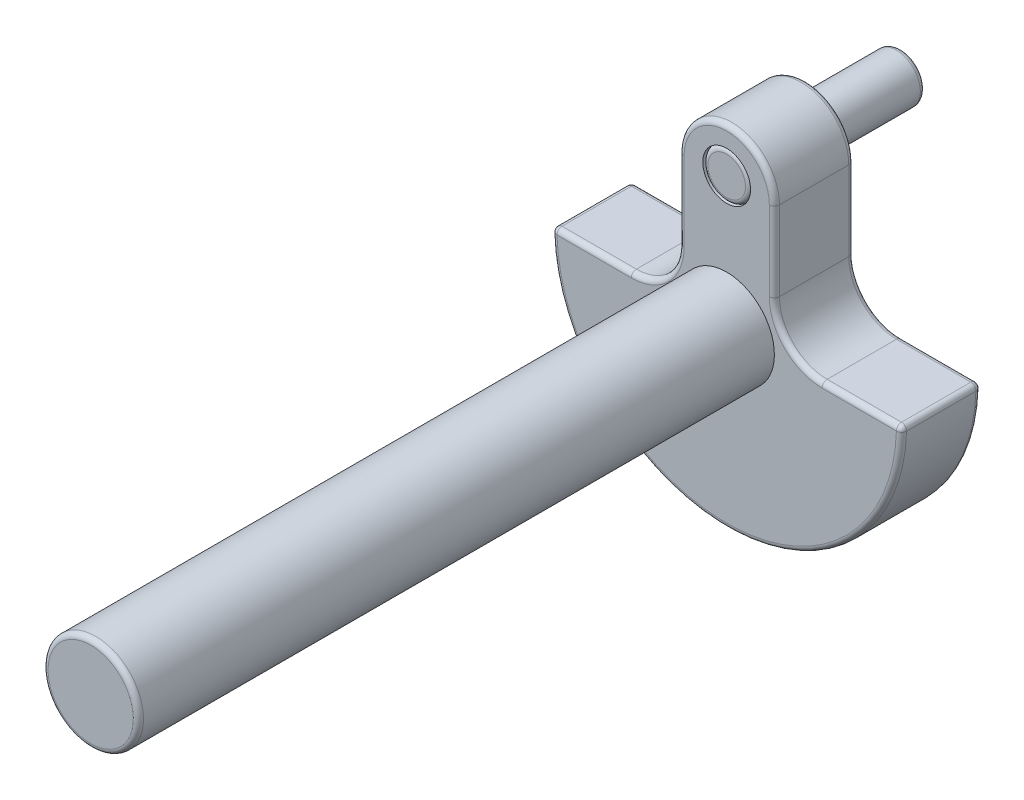
from build123d import *

# Parameters (mm, degrees)
BOSS_EXTRUDE1_DEPTH      = 3.96875
SKETCH2_R                = 1.984375
SKETCH2_R_2              = 1.190625
CUT_EXTRUDE1_DEPTH       = 13.969981869
BOSS_EXTRUDE2_DEPTH      = 4.7625
BOSS_EXTRUDE2_DEPTH_BACK = 3.96875
SKETCH3_R                = 1.190625
FILLET1_R                = 0.254
FILLET2_R                = 0.254
FILLET3_R                = 0.254


with BuildPart() as part:
    # Sketch1 → Boss-Extrude1 (new body)
    with BuildSketch(Plane.XY):
        with BuildLine():
            Line((-2.38125, 6.35), (-2.38125, 2.38125))
            ThreePointArc((-2.38125, 2.38125), (-3.078701977, 0.697451977), (-4.7625, 0))
            Line((-4.7625, 0), (-8.73125, 0))
            ThreePointArc((-8.73125, 0), (0, -8.73125), (8.73125, 0))
            Line((8.73125, 0), (4.7625, 0))
            ThreePointArc((4.7625, 0), (3.078701977, 0.697451977), (2.38125, 2.38125))
            Line((2.38125, 2.38125), (2.38125, 6.35))
            ThreePointArc((2.38125, 6.35), (0, 8.73125), (-2.38125, 6.35))
        make_face()
    extrude(amount=BOSS_EXTRUDE1_DEPTH)

    # Sketch2 → Cut-Extrude1 (cut, through all)
    with BuildSketch(Plane.XY.offset(3.96875)):
        Circle(SKETCH2_R)
        with Locations((0, 6.540794599)):
            Circle(SKETCH2_R_2)
    extrude(amount=-CUT_EXTRUDE1_DEPTH, mode=Mode.SUBTRACT)

    # Fillet1
    fillet1_edges = [part.edges().sort_by_distance(p)[0] for p in [
        (-6.746875, 0, 0),
        (-3.078701977, 0.697451977, 0),
        (-2.38125, 4.365625, 0),
        (0, 8.73125, 0),
        (-3.078701977, 0.697451977, 3.96875),
        (8.73125, 0, 1.984375),
        (-8.73125, 0, 1.984375),
        (-6.746875, 0, 3.96875),
        (0, -8.73125, 3.96875),
        (6.746875, 0, 3.96875),
        (-1.984375, 0, 0),
        (3.078701977, 0.697451977, 3.96875),
        (-1.190625, 6.540794599, 0),
        (2.38125, 4.365625, 3.96875),
        (0, 8.73125, 3.96875),
        (2.38125, 4.365625, 0),
        (-2.38125, 4.365625, 3.96875),
        (3.078701977, 0.697451977, 0),
        (6.746875, 0, 0),
        (0, -8.73125, 0),
    ]]
    fillet(fillet1_edges, radius=FILLET1_R)


with BuildPart() as body_2:
    # Sketch3 → Boss-Extrude2 (new, two sides: drawn at the far end of the back side and taken through both)
    with BuildSketch(Plane(origin=(0, 0, 0), x_dir=(-1, 0, 0), z_dir=(0, 0, -1)).offset(-BOSS_EXTRUDE2_DEPTH_BACK)):
        with Locations((0, 6.540794599)):
            Circle(SKETCH3_R)
    extrude(amount=BOSS_EXTRUDE2_DEPTH + BOSS_EXTRUDE2_DEPTH_BACK)

    # Fillet2
    fillet2_edges = [body_2.edges().sort_by_distance(p)[0] for p in [
        (1.190625, 6.540794599, -4.7625),
        (1.190625, 6.540794599, 3.96875),
    ]]
    fillet(fillet2_edges, radius=FILLET2_R)


with BuildPart() as body_3:
    # Sketch4 → Revolve1 (revolve)
    with BuildSketch(Plane(origin=(0, 0, 0), x_dir=(0, 0, -1), z_dir=(1, 0, 0))):
        Polygon((-35.71875, 0), (-35.71875, 2.38125), (-3.96875, 2.38125), (-3.96875, 1.984375), (0, 1.984375), (0, 0), (-3.96875, 0), align=None)
    revolve(axis=Axis((0, 0, 3.96875), (0, 0, 1)))

    # Fillet3
    fillet3_edges = [body_3.edges().sort_by_distance(p)[0] for p in [
        (0, -2.38125, 35.71875),
    ]]
    fillet(fillet3_edges, radius=FILLET3_R)


solid = Compound([part.part, body_2.part, body_3.part])
